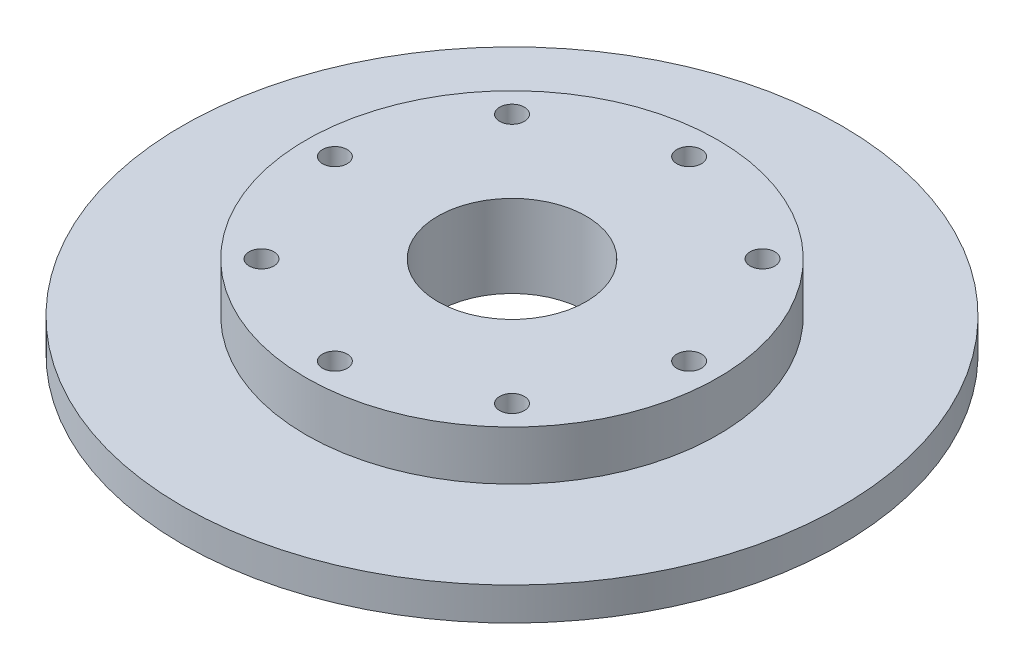
from build123d import *

# Parameters (mm, degrees)
SKETCH1_R           = 40
BOSS_EXTRUDE1_DEPTH = 4
SKETCH2_R           = 25
BOSS_EXTRUDE2_DEPTH = 6
SKETCH3_R           = 1.5
CUT_EXTRUDE1_DEPTH  = 5
SKETCH4_R           = 9
CUT_EXTRUDE2_DEPTH  = 58.445626465
SKETCH5_R           = 1.5
CUT_EXTRUDE3_DEPTH  = 57.789083458
SKETCH6_R           = 2.84
CUT_EXTRUDE4_DEPTH  = 3


with BuildPart() as part:
    # Sketch1 → Boss-Extrude1 (new body)
    with BuildSketch(Plane(origin=(0, 0, 0), x_dir=(1, 0, 0), z_dir=(0, 1, 0))):
        with Locations(Location((0, 0, 0), (0, 0, 270))):
            Circle(SKETCH1_R)
    extrude(amount=BOSS_EXTRUDE1_DEPTH)

    # Sketch2 → Boss-Extrude2 (add)
    with BuildSketch(Plane(origin=(0, 4, 0), x_dir=(1, 0, 0), z_dir=(0, 1, 0))):
        with Locations(Location((0, 0, 0), (0, 0, 270))):
            Circle(SKETCH2_R)
    extrude(amount=BOSS_EXTRUDE2_DEPTH)

    # Sketch3 → Cut-Extrude1 (cut)
    with BuildSketch(Plane(origin=(0, 10, 0), x_dir=(1, 0, 0), z_dir=(0, 1, 0))):
        with Locations(Location((0, -21.5, 0), (0, 0, 270))):
            Circle(SKETCH3_R)
        with Locations(Location((-15.202795796, -15.202795796, 0), (0, 0, 270))):
            Circle(SKETCH3_R)
        with Locations(Location((-21.5, 0, 0), (0, 0, 270))):
            Circle(SKETCH3_R)
        with Locations(Location((-15.202795796, 15.202795796, 0), (0, 0, 270))):
            Circle(SKETCH3_R)
        with Locations(Location((0, 21.5, 0), (0, 0, 270))):
            Circle(SKETCH3_R)
        with Locations(Location((15.202795796, 15.202795796, 0), (0, 0, 270))):
            Circle(SKETCH3_R)
        with Locations(Location((21.5, 0, 0), (0, 0, 270))):
            Circle(SKETCH3_R)
        with Locations(Location((15.202795796, -15.202795796, 0), (0, 0, 270))):
            Circle(SKETCH3_R)
    extrude(amount=-CUT_EXTRUDE1_DEPTH, mode=Mode.SUBTRACT)

    # Sketch4 → Cut-Extrude2 (cut, through all)
    with BuildSketch(Plane(origin=(0, 10, 0), x_dir=(1, 0, 0), z_dir=(0, 1, 0))):
        with Locations(Location((0, 0, 0), (0, 0, 270))):
            Circle(SKETCH4_R)
    extrude(amount=-CUT_EXTRUDE2_DEPTH, mode=Mode.SUBTRACT)

    # Sketch5 → Cut-Extrude3 (cut, through all)
    with BuildSketch(Plane(origin=(0, 5, 0), x_dir=(1, 0, 0), z_dir=(0, 1, 0))):
        with Locations(Location((15.202795796, 15.202795796, 0), (0, 0, 270))):
            Circle(SKETCH5_R)
        with Locations(Location((-15.202795796, -15.202795796, 0), (0, 0, 270))):
            Circle(SKETCH5_R)
    extrude(amount=-CUT_EXTRUDE3_DEPTH, mode=Mode.SUBTRACT)

    # Sketch6 → Cut-Extrude4 (cut)
    with BuildSketch(Plane.XZ):
        with Locations(Location((-15.202795796, 15.202795796, 0), (0, 0, 270))):
            Circle(SKETCH6_R)
        with Locations(Location((15.202795796, -15.202795796, 0), (0, 0, 270))):
            Circle(SKETCH6_R)
    extrude(amount=-CUT_EXTRUDE4_DEPTH, mode=Mode.SUBTRACT)


solid = part.part
